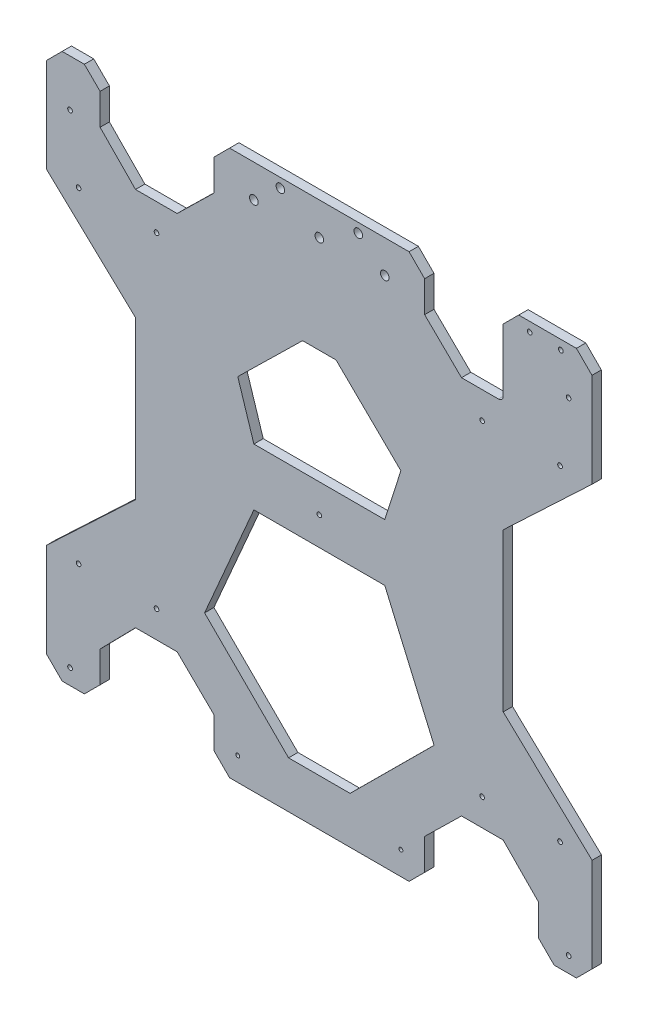
from build123d import *

# Parameters (mm, degrees)
SCHIZZO13_R                  = 1.5
SCHIZZO13_R_2                = 2.75
SCHIZZO13_R_3                = 1.25
ESTRUSIONE_ESTRUSIONE2_DEPTH = 6


with BuildPart() as part:
    # Schizzo13 → Estrusione-Estrusione2 (new body)
    with BuildSketch(Plane.XY):
        with BuildLine():
            Line((9.919241786, 0), (24.201199756, 0))
            Line((24.201199756, 0), (34.201199756, 10))
            Line((34.201199756, 10), (34.28195797, 30))
            Line((34.28195797, 30), (57.017366293, 53.192694567))
            Line((57.017366293, 53.192694567), (83.745372993, 53.192694567))
            Line((83.745372993, 53.192694567), (107.404551383, 30))
            Line((107.404551383, 30), (107.404551383, 10))
            Line((107.404551383, 10), (117.404551383, 0))
            Line((117.404551383, 0), (232.595448617, 0))
            Line((232.595448617, 0), (242.595448617, 10))
            Line((242.595448617, 10), (242.595448617, 30))
            Line((242.595448617, 30), (266.254627007, 53.192694567))
            Line((266.254627007, 53.192694567), (292.982633707, 53.192694567))
            Line((292.982633707, 53.192694567), (315.71804203, 30))
            Line((315.71804203, 30), (315.71804203, 10))
            Line((315.71804203, 10), (325.71804203, 0))
            Line((325.71804203, 0), (340, 0))
            Line((340, 0), (350, 10))
            Line((350, 10), (350.080758214, 70.5))
            Line((350.080758214, 70.5), (293, 124.388863529))
            Line((293, 124.388863529), (293, 225.611136471))
            Line((293, 225.611136471), (350.080758214, 279.5))
            Line((350.080758214, 279.5), (350, 340))
            Line((350, 340), (340, 350))
            Line((340, 350), (302.982633707, 350))
            Line((302.982633707, 350), (292.982633707, 340))
            Line((292.982633707, 340), (292.982633707, 299.807305433))
            ThreePointArc((292.982633707, 299.807305433), (292.103954051, 297.685985089), (289.982633707, 296.807305433))
            Line((289.982633707, 296.807305433), (266.254627007, 296.807305433))
            Line((266.254627007, 296.807305433), (242.595448617, 320))
            Line((242.595448617, 320), (242.595448617, 340))
            Line((242.595448617, 340), (232.595448617, 350))
            Line((232.595448617, 350), (117.404551383, 350))
            Line((117.404551383, 350), (107.404551383, 340))
            Line((107.404551383, 340), (107.404551383, 320))
            Line((107.404551383, 320), (83.745372993, 296.807305433))
            Line((83.745372993, 296.807305433), (57.017366293, 296.807305433))
            Line((57.017366293, 296.807305433), (34.28195797, 320))
            Line((34.28195797, 320), (34.28195797, 340))
            Line((34.28195797, 340), (24.201199756, 350))
            Line((24.201199756, 350), (9.919241786, 350))
            Line((9.919241786, 350), (-0.080758214, 340))
            Line((-0.080758214, 340), (-0.080758214, 279.5))
            Line((-0.080758214, 279.5), (57, 225.611136471))
            Line((57, 225.611136471), (57, 175))
            Line((57, 175), (57, 124.388863529))
            Line((57, 124.388863529), (-0.080758214, 70.5))
            Line((-0.080758214, 70.5), (-0.080758214, 10))
            Line((-0.080758214, 10), (9.919241786, 0))
        make_face()
        with Locations((15, 320)):
            Circle(SCHIZZO13_R, mode=Mode.SUBTRACT)
        with Locations((20.5, 279.5)):
            Circle(SCHIZZO13_R, mode=Mode.SUBTRACT)
        with Locations((70.5, 279.5)):
            Circle(SCHIZZO13_R, mode=Mode.SUBTRACT)
        with Locations((175, 175)):
            Circle(SCHIZZO13_R, mode=Mode.SUBTRACT)
        with Locations((20.5, 70.5)):
            Circle(SCHIZZO13_R, mode=Mode.SUBTRACT)
        with Locations((200, 344)):
            Circle(SCHIZZO13_R_2, mode=Mode.SUBTRACT)
        with Locations(Location((150, 344, 0), (0, 0, 180))):
            Circle(SCHIZZO13_R_2, mode=Mode.SUBTRACT)
        with Locations((175, 329)):
            Circle(SCHIZZO13_R_2, mode=Mode.SUBTRACT)
        with Locations((217, 329)):
            Circle(SCHIZZO13_R_2, mode=Mode.SUBTRACT)
        with Locations(Location((133, 329, 0), (0, 0, 180))):
            Circle(SCHIZZO13_R_2, mode=Mode.SUBTRACT)
        with Locations((70.5, 70.5)):
            Circle(SCHIZZO13_R, mode=Mode.SUBTRACT)
        with Locations((279.5, 70.5)):
            Circle(SCHIZZO13_R, mode=Mode.SUBTRACT)
        with Locations((329.5, 70.5)):
            Circle(SCHIZZO13_R, mode=Mode.SUBTRACT)
        with Locations((335, 10)):
            Circle(SCHIZZO13_R, mode=Mode.SUBTRACT)
        with Locations((15, 10)):
            Circle(SCHIZZO13_R, mode=Mode.SUBTRACT)
        with Locations((279.5, 279.5)):
            Circle(SCHIZZO13_R, mode=Mode.SUBTRACT)
        with Locations((329.5, 279.5)):
            Circle(SCHIZZO13_R, mode=Mode.SUBTRACT)
        with Locations((335, 320)):
            Circle(SCHIZZO13_R, mode=Mode.SUBTRACT)
        with Locations((310, 344)):
            Circle(SCHIZZO13_R, mode=Mode.SUBTRACT)
        with Locations((330, 344)):
            Circle(SCHIZZO13_R, mode=Mode.SUBTRACT)
        with Locations((122.656966622, 15)):
            Circle(SCHIZZO13_R_3, mode=Mode.SUBTRACT)
        with Locations(Location((227.343033378, 15, 0), (0, 0, 180))):
            Circle(SCHIZZO13_R_3, mode=Mode.SUBTRACT)
        Polygon((217, 193.286910978), (227.343033378, 225.611136471), (185.750894453, 266.383210572), (164.249105547, 266.383210572), (122.656966622, 225.611136471), (133, 193.286910978), align=None, mode=Mode.SUBTRACT)
        Polygon((133, 156.713089022), (101.348199345, 83.616789428), (155.254193112, 30), (194.745806888, 30), (248.651800655, 83.616789428), (217, 156.713089022), align=None, mode=Mode.SUBTRACT)
    extrude(amount=-ESTRUSIONE_ESTRUSIONE2_DEPTH)


solid = part.part
